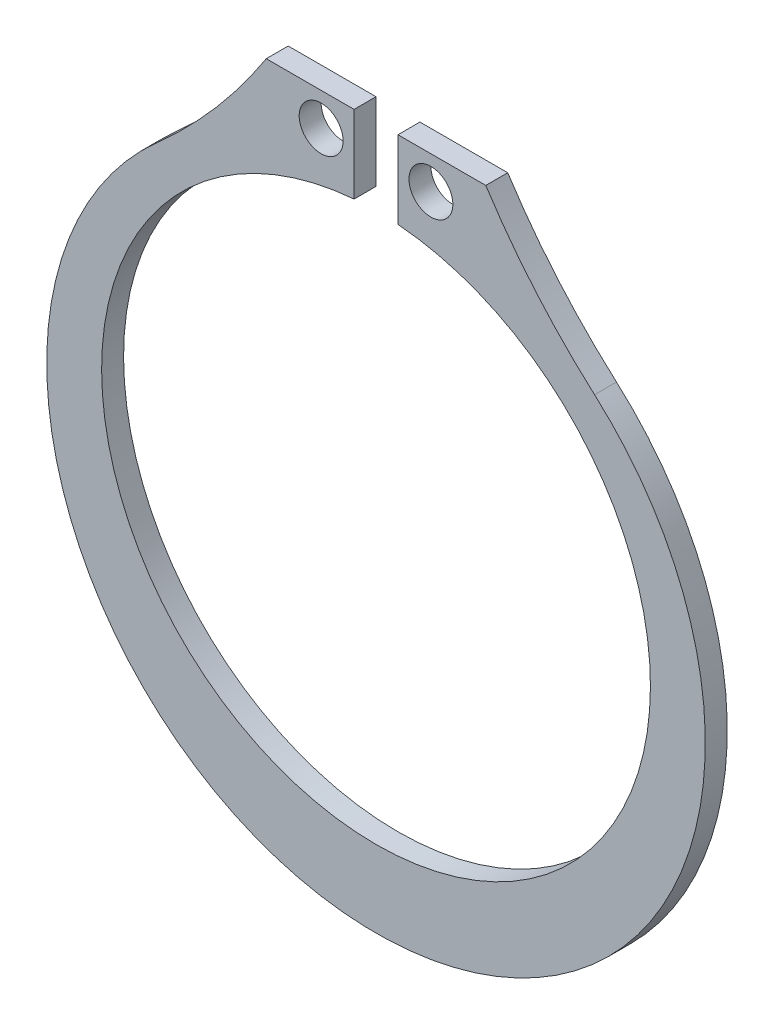
from build123d import *

# Parameters (mm, degrees)
SKETCH1_R           = 1
BOSS_EXTRUDE1_DEPTH = 1


with BuildPart() as part:
    # Sketch1 → Boss-Extrude1 (new body)
    with BuildSketch(Plane.XY):
        with BuildLine():
            Line((-5, 17), (-1, 17))
            Line((-1, 17), (-1, 13.459935794))
            ThreePointArc((-1, 13.459935794), (0, -11.5), (1, 13.459935794))
            Line((1, 13.459935794), (1, 17))
            Line((1, 17), (5, 17))
            ThreePointArc((5, 17), (7.280116529, 13.941078138), (9.954900605, 11.22051487))
            ThreePointArc((9.954900605, 11.22051487), (0, -15), (-9.954900605, 11.22051487))
            ThreePointArc((-9.954900605, 11.22051487), (-7.280116529, 13.941078138), (-5, 17))
        make_face()
        with Locations((-2.5, 15.5)):
            Circle(SKETCH1_R, mode=Mode.SUBTRACT)
        with Locations(Location((2.5, 15.5, 0), (0, 0, 180))):
            Circle(SKETCH1_R, mode=Mode.SUBTRACT)
    extrude(amount=BOSS_EXTRUDE1_DEPTH)


solid = part.part
